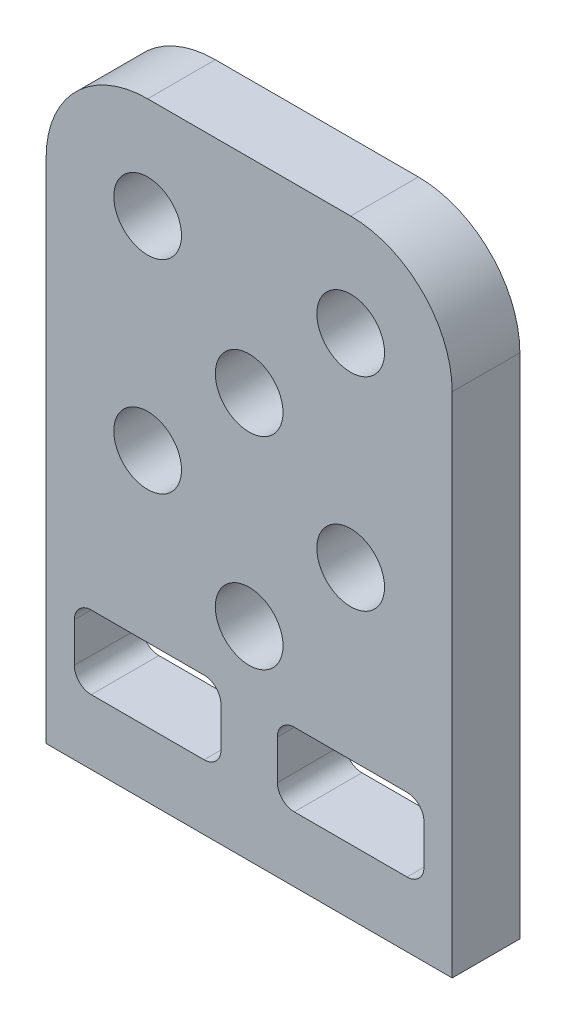
from build123d import *

# Parameters (mm, degrees)
MODEL_R                 = 1.5
SALIENTE_EXTRUIR1_DEPTH = 3


with BuildPart() as part:
    # Model → Saliente-Extruir1 (new body)
    with BuildSketch(Plane.XY):
        with BuildLine():
            Line((174.227054575, 190.675884941), (192.227054575, 190.675884941))
            Line((192.227054575, 190.675884941), (192.227054575, 213.178720063))
            ThreePointArc((192.227054575, 213.178720063), (190.90903509, 216.360700578), (187.727054575, 217.678720063))
            Line((187.727054575, 217.678720063), (178.727054575, 217.678720063))
            ThreePointArc((178.727054575, 217.678720063), (175.545074059, 216.360700578), (174.227054575, 213.178720063))
            Line((174.227054575, 213.178720063), (174.227054575, 190.675884941))
        make_face()
        with Locations((183.227054575, 199.678720063)):
            Circle(MODEL_R, mode=Mode.SUBTRACT)
        with Locations((183.227054575, 208.632069818)):
            Circle(MODEL_R, mode=Mode.SUBTRACT)
        with Locations((187.727054575, 204.178720063)):
            Circle(MODEL_R, mode=Mode.SUBTRACT)
        with Locations((178.727054575, 204.178720063)):
            Circle(MODEL_R, mode=Mode.SUBTRACT)
        with Locations((187.727054575, 213.178720063)):
            Circle(MODEL_R, mode=Mode.SUBTRACT)
        with Locations((178.727054575, 213.178720063)):
            Circle(MODEL_R, mode=Mode.SUBTRACT)
        with BuildLine():
            Line((190.227058417, 193.553720063), (185.227058417, 193.553720063))
            ThreePointArc((185.227058417, 193.553720063), (184.696728331, 193.773389977), (184.477058417, 194.303720063))
            Line((184.477058417, 194.303720063), (184.477058417, 196.053720063))
            ThreePointArc((184.477058417, 196.053720063), (184.696728331, 196.584050149), (185.227058417, 196.803720063))
            Line((185.227058417, 196.803720063), (190.227058417, 196.803720063))
            ThreePointArc((190.227058417, 196.803720063), (190.757388503, 196.584050149), (190.977058417, 196.053720063))
            Line((190.977058417, 196.053720063), (190.977058417, 194.303720063))
            ThreePointArc((190.977058417, 194.303720063), (190.757388503, 193.773389977), (190.227058417, 193.553720063))
        make_face(mode=Mode.SUBTRACT)
        with BuildLine():
            Line((181.227058417, 193.553720063), (176.227058417, 193.553720063))
            ThreePointArc((176.227058417, 193.553720063), (175.696728331, 193.773389977), (175.477058417, 194.303720063))
            Line((175.477058417, 194.303720063), (175.477058417, 196.053720063))
            ThreePointArc((175.477058417, 196.053720063), (175.696728331, 196.584050149), (176.227058417, 196.803720063))
            Line((176.227058417, 196.803720063), (181.227058417, 196.803720063))
            ThreePointArc((181.227058417, 196.803720063), (181.757388503, 196.584050149), (181.977058417, 196.053720063))
            Line((181.977058417, 196.053720063), (181.977058417, 194.303720063))
            ThreePointArc((181.977058417, 194.303720063), (181.757388503, 193.773389977), (181.227058417, 193.553720063))
        make_face(mode=Mode.SUBTRACT)
    extrude(amount=SALIENTE_EXTRUIR1_DEPTH)


solid = part.part
